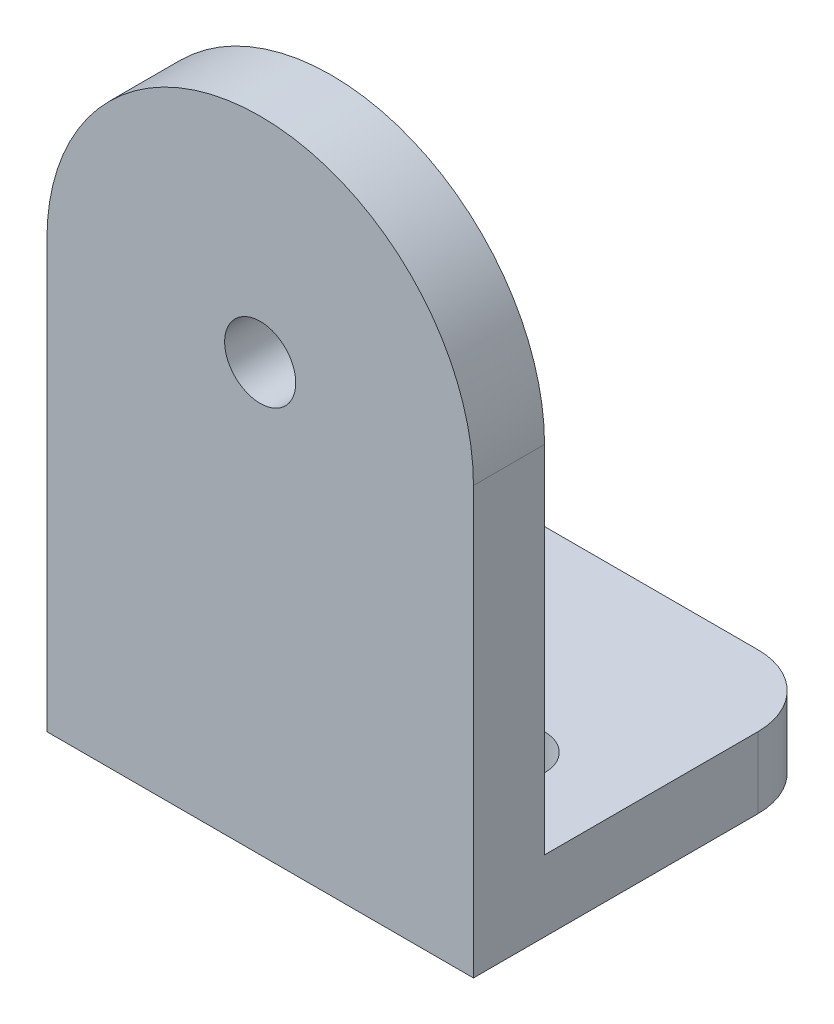
from build123d import *

# Parameters (mm, degrees)
IZIM1_R                     = 2.5
Y_KSEKLIK_EKSTR_ZYON1_DEPTH = 25
IZIM2_W                     = 20
IZIM2_H                     = 40
KES_EKSTR_ZYON1_DEPTH       = 47
RADYUS1_R                   = 5
IZIM3_R                     = 2.5
KES_EKSTR_ZYON3_DEPTH       = 47


with BuildPart() as part:
    # Çizim1 → Yükseklik-Ekstrüzyon1 (new body)
    with BuildSketch(Plane.XY):
        with BuildLine():
            Line((-30.949719985, 7.301527432), (-30.949719985, -22.698472568))
            Line((-30.949719985, -22.698472568), (-0.949719985, -22.698472568))
            Line((-0.949719985, -22.698472568), (-0.949719985, 7.301527432))
            ThreePointArc((-0.949719985, 7.301527432), (-15.949719985, 22.301527432), (-30.949719985, 7.301527432))
        make_face()
        with Locations((-15.949719985, 7.301527432)):
            Circle(IZIM1_R, mode=Mode.SUBTRACT)
    extrude(amount=Y_KSEKLIK_EKSTR_ZYON1_DEPTH)

    # Çizim2 → Kes-Ekstrüzyon1 (cut)
    with BuildSketch(Plane(origin=(0, 0, 0), x_dir=(0, 0, -1), z_dir=(1, 0, 0))):
        with Locations((-10, 2.301527432)):
            Rectangle(IZIM2_W, IZIM2_H)
    extrude(amount=-KES_EKSTR_ZYON1_DEPTH, mode=Mode.SUBTRACT)

    # Radyus1
    radyus1_edges = [part.edges().sort_by_distance(p)[0] for p in [
        (-30.949719985, -20.198472568, 0),
        (-0.949719985, -20.198472568, 0),
    ]]
    fillet(radyus1_edges, radius=RADYUS1_R)

    # Çizim3 → Kes-Ekstrüzyon3 (cut)
    with BuildSketch(Plane(origin=(0, 0, 0), x_dir=(1, 0, 0), z_dir=(0, 1, 0))):
        with Locations(Location((-23.449719985, -15, 0), (0, 0, 270))):
            Circle(IZIM3_R)
        with Locations(Location((-8.449719985, -15, 0), (0, 0, 270))):
            Circle(IZIM3_R)
    extrude(amount=-KES_EKSTR_ZYON3_DEPTH, mode=Mode.SUBTRACT)


solid = part.part
